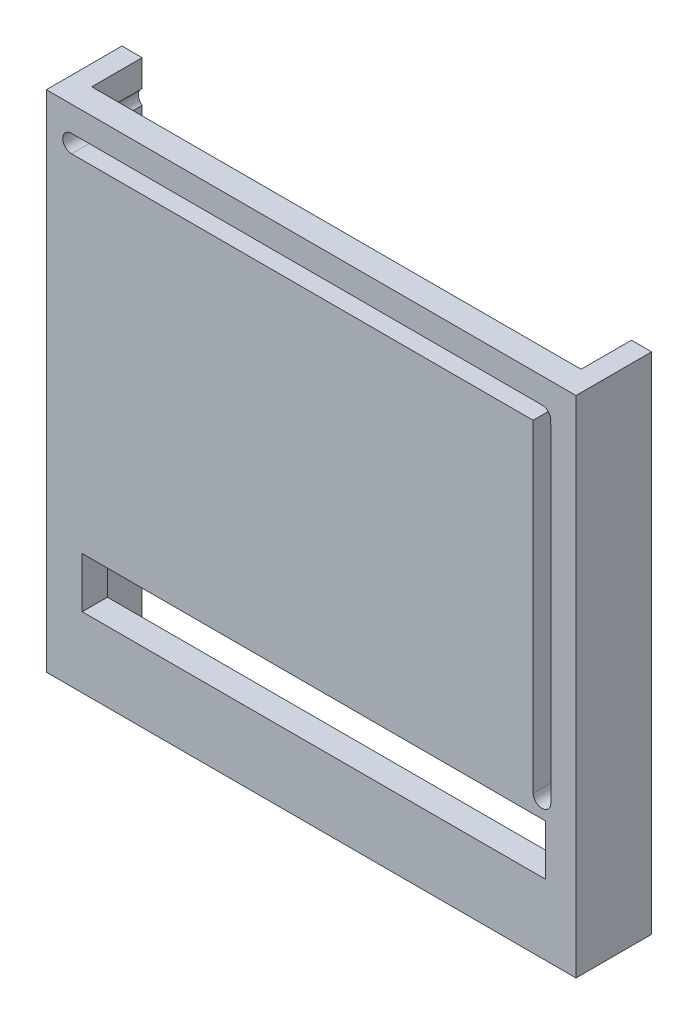
from build123d import *

# Parameters (mm, degrees)
SKETCH1_W           = 210
SKETCH1_H           = 200
BOSS_EXTRUDE1_DEPTH = 30
SKETCH2_W           = 194
SKETCH2_H           = 20
CUT_EXTRUDE1_DEPTH  = 228.870577302
CUT_EXTRUDE2_DEPTH  = 149.07092895
CUT_EXTRUDE3_DEPTH  = 149.07092895
SKETCH6_W           = 183.698961066
SKETCH6_H           = 20
CUT_EXTRUDE4_DEPTH  = 147.372811683
CUT_EXTRUDE6_DEPTH  = 5


with BuildPart() as part:
    # Sketch1 → Boss-Extrude1 (new body)
    with BuildSketch(Plane.XY):
        Rectangle(SKETCH1_W, SKETCH1_H)
    extrude(amount=BOSS_EXTRUDE1_DEPTH)

    # Sketch2 → Cut-Extrude1 (cut, through all)
    with BuildSketch(Plane(origin=(0, -100, 0), x_dir=(-1, 0, 0), z_dir=(0, -1, 0))):
        with Locations((0, -10)):
            Rectangle(SKETCH2_W, SKETCH2_H)
    extrude(amount=-CUT_EXTRUDE1_DEPTH, mode=Mode.SUBTRACT)

    # Sketch3 → Cut-Extrude2 (cut, through all)
    with BuildSketch(Plane.XY.offset(30)):
        with BuildLine():
            Line((88, 85), (88, -45))
            ThreePointArc((88, -45), (91.5, -48.5), (95, -45))
            Line((95, -45), (95, 85))
            ThreePointArc((95, 85), (91.5, 88.5), (88, 85))
        make_face()
    extrude(amount=-CUT_EXTRUDE2_DEPTH, mode=Mode.SUBTRACT)

    # Sketch4 → Cut-Extrude3 (cut, through all)
    with BuildSketch(Plane.XY.offset(30)):
        with BuildLine():
            Line((91.5, 83), (-95, 83))
            ThreePointArc((-95, 83), (-98.5, 86.5), (-95, 90))
            Line((-95, 90), (91.5, 90))
            ThreePointArc((91.5, 90), (95, 86.5), (91.5, 83))
        make_face()
    extrude(amount=-CUT_EXTRUDE3_DEPTH, mode=Mode.SUBTRACT)

    # Sketch6 → Cut-Extrude4 (cut, through all)
    with BuildSketch(Plane(origin=(0, 0, 20), x_dir=(-1, 0, 0), z_dir=(0, 0, -1))):
        with Locations((-1.082669049, -62.138985898)):
            Rectangle(SKETCH6_W, SKETCH6_H)
    extrude(amount=-CUT_EXTRUDE4_DEPTH, mode=Mode.SUBTRACT)

    # Sketch5 → Cut-Extrude6 (cut)
    with BuildSketch(Plane(origin=(0, -100, 0), x_dir=(-1, 0, 0), z_dir=(0, -1, 0))):
        with BuildLine():
            Line((90, -27), (-90, -27))
            ThreePointArc((-90, -27), (-92.5, -24.5), (-90, -22))
            Line((-90, -22), (90, -22))
            ThreePointArc((90, -22), (92.5, -24.5), (90, -27))
        make_face()
    extrude(amount=-CUT_EXTRUDE6_DEPTH, mode=Mode.SUBTRACT)


solid = part.part
